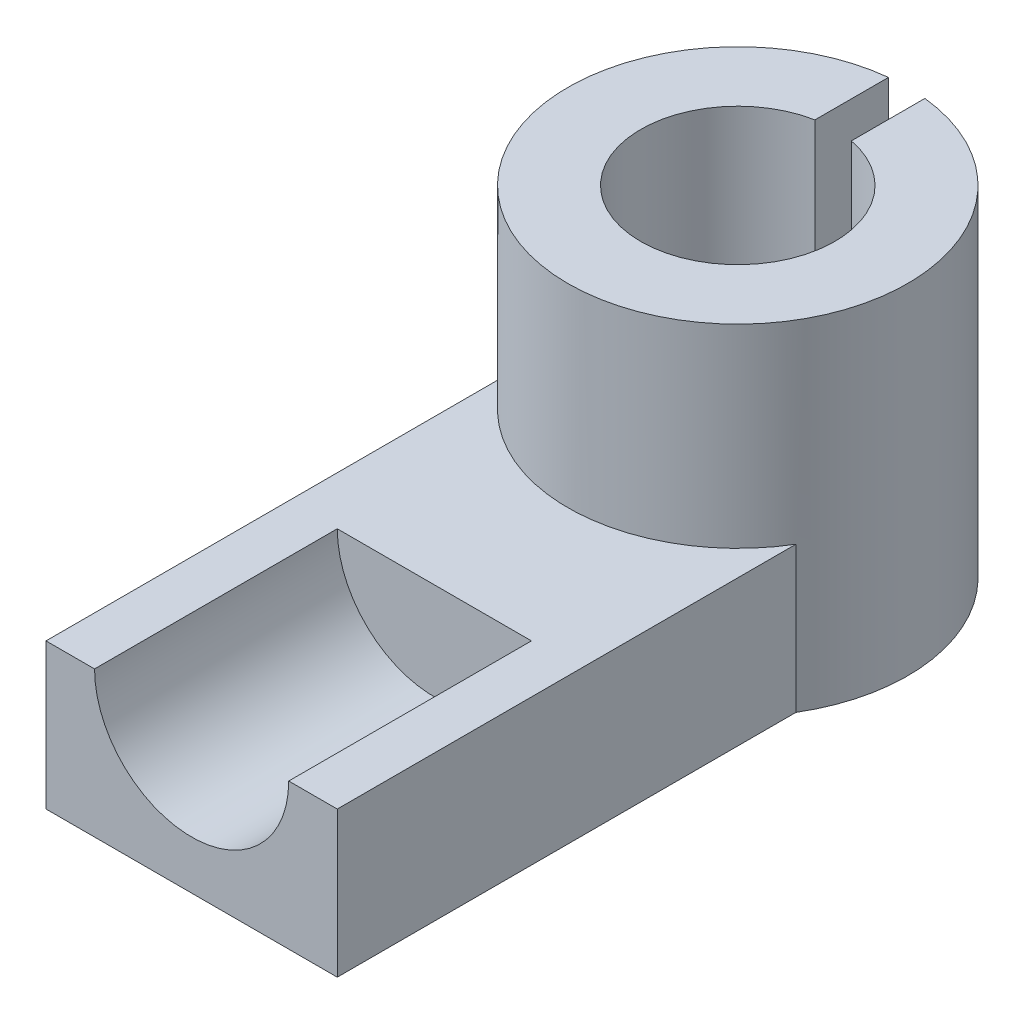
from build123d import *

# Parameters (mm, degrees)
SKETCH1_R           = 28
SKETCH1_R_2         = 16
BOSS_EXTRUDE1_DEPTH = 56
CUT_EXTRUDE1_REACH  = 70.586
SKETCH3_W           = 6
SKETCH3_H           = 37.426603074
BOSS_EXTRUDE3_DEPTH = 24
SKETCH5_R           = 16
CUT_EXTRUDE2_DEPTH  = 40


with BuildPart() as part:
    # Sketch1 → Boss-Extrude1 (new body)
    with BuildSketch(Plane(origin=(0, 0, 0), x_dir=(1, 0, 0), z_dir=(0, 1, 0))):
        with Locations(Location((0, 0, 0), (0, 0, 270))):
            Circle(SKETCH1_R)
        with Locations(Location((0, 0, 0), (0, 0, 270))):
            Circle(SKETCH1_R_2, mode=Mode.SUBTRACT)
    extrude(amount=BOSS_EXTRUDE1_DEPTH)

    # Sketch3 → Cut-Extrude1 (cut, up to next)
    with BuildSketch(Plane(origin=(0, 56, 0), x_dir=(1, 0, 0), z_dir=(0, 1, 0)), mode=Mode.PRIVATE) as cut_extrude1_sk1:
        with Locations((0, 16)):
            Rectangle(SKETCH3_W, SKETCH3_H)
    cut_extrude1_tool1 = extrude(cut_extrude1_sk1.sketch, amount=-CUT_EXTRUDE1_REACH, mode=Mode.PRIVATE) & part.part
    add(cut_extrude1_tool1.solids().sort_by_distance((0, 56, -16))[0], mode=Mode.SUBTRACT)

    # Sketch4 → Boss-Extrude3 (add)
    with BuildSketch(Plane.XZ):
        with BuildLine():
            Line((-24, 90), (24, 90))
            Line((24, 90), (24, 14.422205102))
            ThreePointArc((24, 14.422205102), (0, 28), (-24, 14.422205102))
            Line((-24, 14.422205102), (-24, 90))
        make_face()
    extrude(amount=-BOSS_EXTRUDE3_DEPTH)

    # Sketch5 → Cut-Extrude2 (cut)
    with BuildSketch(Plane.XY.offset(90)):
        with Locations((0, 24)):
            Circle(SKETCH5_R)
    extrude(amount=-CUT_EXTRUDE2_DEPTH, mode=Mode.SUBTRACT)


solid = part.part
